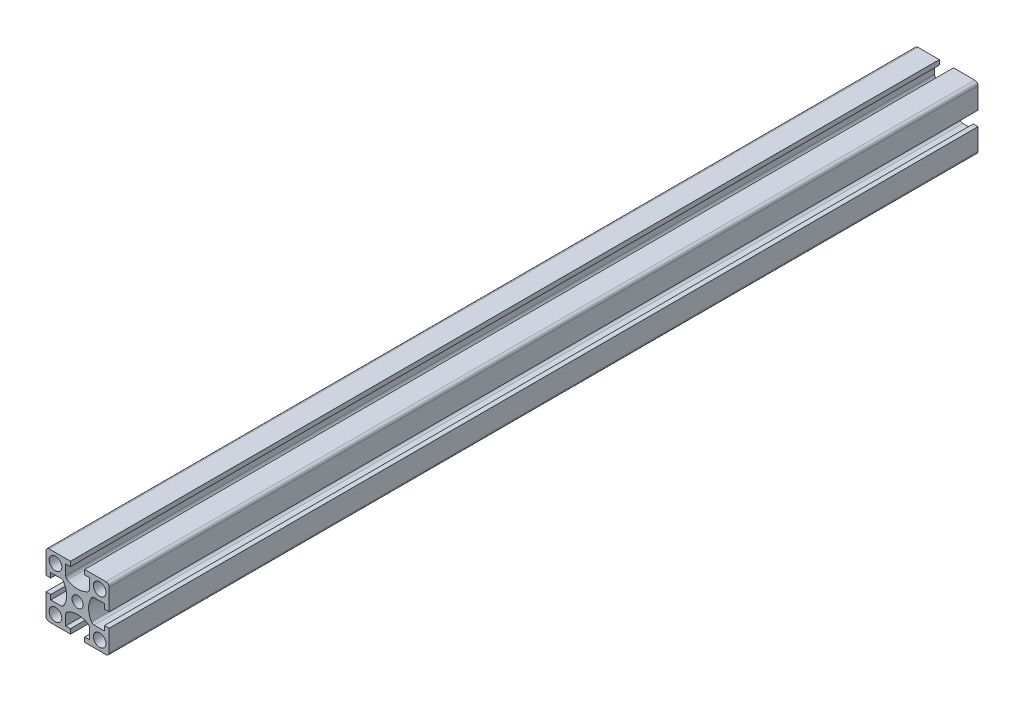
from build123d import *

# Parameters (mm, degrees)
SKETCH1_R           = 2
SKETCH1_R_2         = 1.75
BOSS_EXTRUDE1_DEPTH = 275


with BuildPart() as part:
    # Sketch1 → Boss-Extrude1 (new body)
    with BuildSketch(Plane.XY):
        with BuildLine():
            Line((-10, 9), (-10, 2.25))
            Line((-10, 2.25), (-8.5, 2.25))
            Line((-8.5, 2.25), (-8.5, 3.75))
            Line((-8.5, 3.75), (-5.236860279, 3.75))
            ThreePointArc((-5.236860279, 3.75), (-4.736860279, 3.616025404), (-4.370834875, 3.25))
            ThreePointArc((-4.370834875, 3.25), (-3.5, 0), (-4.370834875, -3.25))
            ThreePointArc((-4.370834875, -3.25), (-4.736860279, -3.616025404), (-5.236860279, -3.75))
            Line((-5.236860279, -3.75), (-8.5, -3.75))
            Line((-8.5, -3.75), (-8.5, -2.25))
            Line((-8.5, -2.25), (-10, -2.25))
            Line((-10, -2.25), (-10, -9))
            ThreePointArc((-10, -9), (-9.707106781, -9.707106781), (-9, -10))
            Line((-9, -10), (-2.25, -10))
            Line((-2.25, -10), (-2.25, -8.5))
            Line((-2.25, -8.5), (-3.75, -8.5))
            Line((-3.75, -8.5), (-3.75, -5.236860279))
            ThreePointArc((-3.75, -5.236860279), (-3.616025404, -4.736860279), (-3.25, -4.370834875))
            ThreePointArc((-3.25, -4.370834875), (0, -3.5), (3.25, -4.370834875))
            ThreePointArc((3.25, -4.370834875), (3.616025404, -4.736860279), (3.75, -5.236860279))
            Line((3.75, -5.236860279), (3.75, -8.5))
            Line((3.75, -8.5), (2.25, -8.5))
            Line((2.25, -8.5), (2.25, -10))
            Line((2.25, -10), (9, -10))
            ThreePointArc((9, -10), (9.707106781, -9.707106781), (10, -9))
            Line((10, -9), (10, -2.25))
            Line((10, -2.25), (8.5, -2.25))
            Line((8.5, -2.25), (8.5, -3.75))
            Line((8.5, -3.75), (5.236860279, -3.75))
            ThreePointArc((5.236860279, -3.75), (4.736860279, -3.616025404), (4.370834875, -3.25))
            ThreePointArc((4.370834875, -3.25), (3.5, 0), (4.370834875, 3.25))
            ThreePointArc((4.370834875, 3.25), (4.736860279, 3.616025404), (5.236860279, 3.75))
            Line((5.236860279, 3.75), (8.5, 3.75))
            Line((8.5, 3.75), (8.5, 2.25))
            Line((8.5, 2.25), (10, 2.25))
            Line((10, 2.25), (10, 9))
            ThreePointArc((10, 9), (9.707106781, 9.707106781), (9, 10))
            Line((9, 10), (2.25, 10))
            Line((2.25, 10), (2.25, 8.5))
            Line((2.25, 8.5), (3.75, 8.5))
            Line((3.75, 8.5), (3.75, 5.236860279))
            ThreePointArc((3.75, 5.236860279), (3.616025404, 4.736860279), (3.25, 4.370834875))
            ThreePointArc((3.25, 4.370834875), (0, 3.5), (-3.25, 4.370834875))
            ThreePointArc((-3.25, 4.370834875), (-3.616025404, 4.736860279), (-3.75, 5.236860279))
            Line((-3.75, 5.236860279), (-3.75, 8.5))
            Line((-3.75, 8.5), (-2.25, 8.5))
            Line((-2.25, 8.5), (-2.25, 10))
            Line((-2.25, 10), (-9, 10))
            ThreePointArc((-9, 10), (-9.707106781, 9.707106781), (-10, 9))
        make_face()
        with Locations((-7, -7)):
            Circle(SKETCH1_R, mode=Mode.SUBTRACT)
        with Locations((7, -7)):
            Circle(SKETCH1_R, mode=Mode.SUBTRACT)
        with Locations((7, 7)):
            Circle(SKETCH1_R, mode=Mode.SUBTRACT)
        Circle(SKETCH1_R_2, mode=Mode.SUBTRACT)
        with Locations((-7, 7)):
            Circle(SKETCH1_R, mode=Mode.SUBTRACT)
    extrude(amount=BOSS_EXTRUDE1_DEPTH)


solid = part.part
